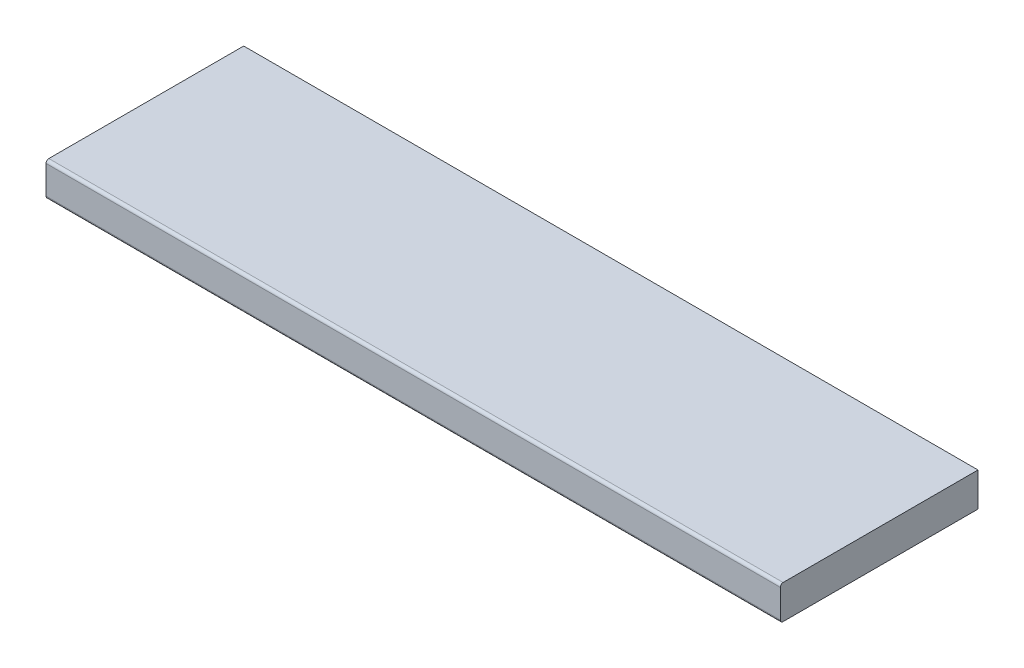
from build123d import *

# Parameters (mm, degrees)
SKETCH_1_W        = 1300
SKETCH_1_H        = 60
EXTRUDE_253_DEPTH = 350
FILLET_2_R        = 5


with BuildPart() as part:
    # Эскиз1 → Extrude 253 (new body)
    with BuildSketch(Plane.XY):
        with Locations((451.052631579, -1.263157895)):
            Rectangle(SKETCH_1_W, SKETCH_1_H)
    extrude(amount=EXTRUDE_253_DEPTH)

    # Скругление2
    fillet_2_edges = [part.edges().sort_by_distance(p)[0] for p in [
        (451.052631579, 28.736842105, 350),
        (451.052631579, -31.263157895, 350),
    ]]
    fillet(fillet_2_edges, radius=FILLET_2_R)


solid = part.part
